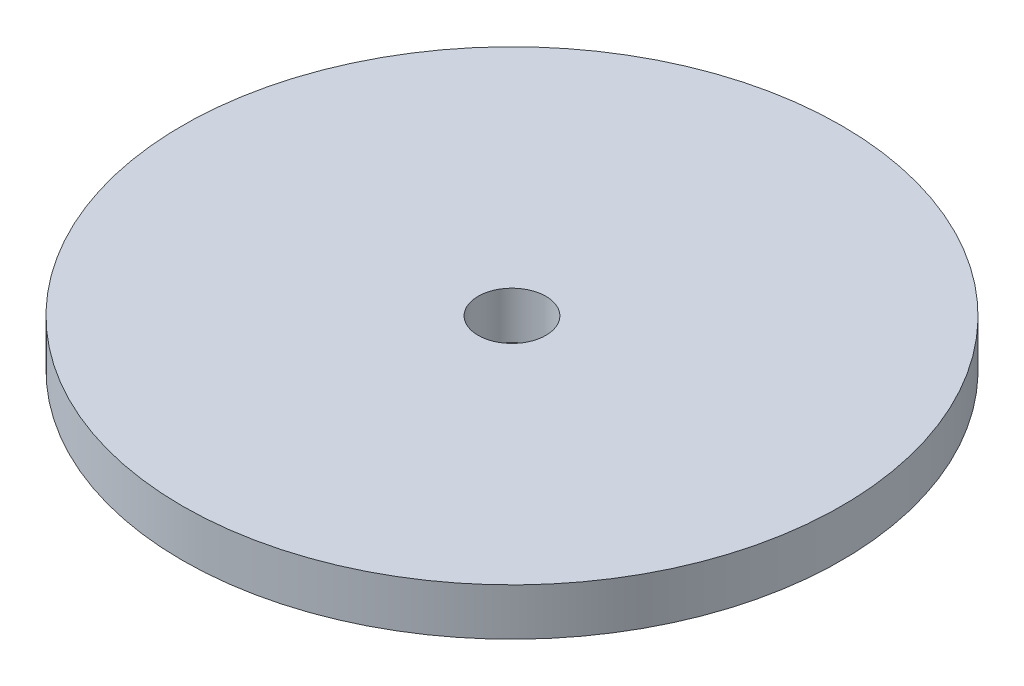
from build123d import *

# Parameters (mm, degrees)
SKETCH1_R           = 44.45
SKETCH1_R_2         = 4.572
BOSS_EXTRUDE1_DEPTH = 6.35


with BuildPart() as part:
    # Sketch1 → Boss-Extrude1 (new body)
    with BuildSketch(Plane(origin=(0, 0, 0), x_dir=(1, 0, 0), z_dir=(0, 1, 0))):
        with Locations(Location((0, 0, 0), (0, 0, 270))):
            Circle(SKETCH1_R)
        with Locations(Location((0, 0, 0), (0, 0, 270))):
            Circle(SKETCH1_R_2, mode=Mode.SUBTRACT)
    extrude(amount=BOSS_EXTRUDE1_DEPTH)


solid = part.part
